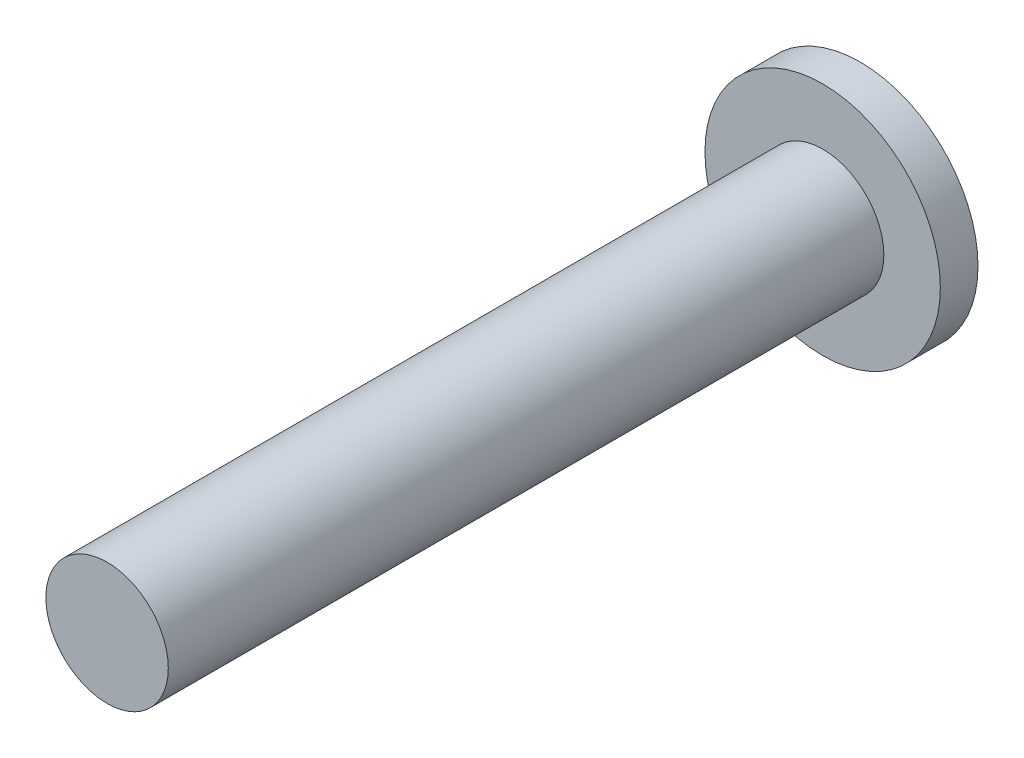
from build123d import *

# Parameters (mm, degrees)
SKETCH1_R           = 12.5
BOSS_EXTRUDE1_DEPTH = 4
SKETCH2_R           = 6.5
BOSS_EXTRUDE2_DEPTH = 80


with BuildPart() as part:
    # Sketch1 → Boss-Extrude1 (new body)
    with BuildSketch(Plane.XY):
        Circle(SKETCH1_R)
    extrude(amount=BOSS_EXTRUDE1_DEPTH)

    # Sketch2 → Boss-Extrude2 (add)
    with BuildSketch(Plane.XY):
        Circle(SKETCH2_R)
    extrude(amount=BOSS_EXTRUDE2_DEPTH)


solid = part.part
